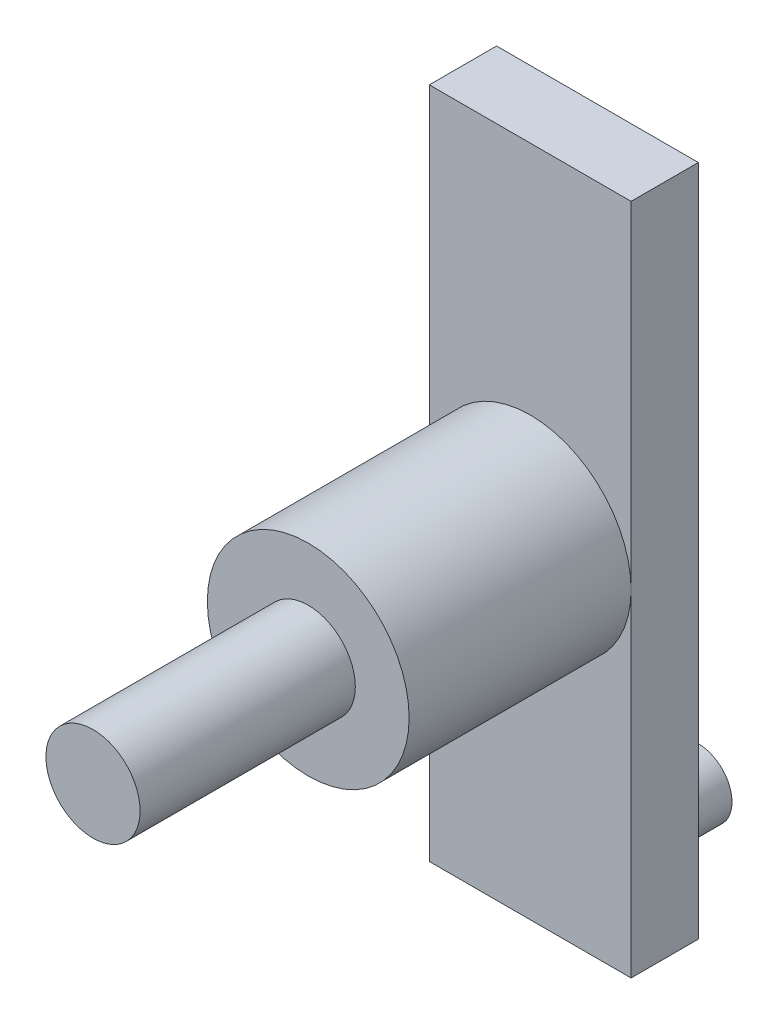
from build123d import *

# Parameters (mm, degrees)
SKETCH1_R           = 7
BOSS_EXTRUDE1_DEPTH = 65
SKETCH1_3_R         = 15
SKETCH1_3_R_2       = 7
BOSS_EXTRUDE2_DEPTH = 33
SKETCH3_W           = 30
SKETCH3_H           = 100
BOSS_EXTRUDE4_DEPTH = 10
SKETCH4_R           = 5
BOSS_EXTRUDE5_DEPTH = 15


with BuildPart() as part:
    # Sketch1 → Boss-Extrude1 (new body)
    with BuildSketch(Plane.XY):
        Circle(SKETCH1_R)
    extrude(amount=BOSS_EXTRUDE1_DEPTH)

    # Sketch1<3> → Boss-Extrude2 (add)
    with BuildSketch(Plane.XY):
        Circle(SKETCH1_3_R)
        Circle(SKETCH1_3_R_2, mode=Mode.SUBTRACT)
    extrude(amount=BOSS_EXTRUDE2_DEPTH)

    # Sketch3 → Boss-Extrude4 (add)
    with BuildSketch(Plane(origin=(0, 0, 0), x_dir=(-1, 0, 0), z_dir=(0, 0, -1))):
        Rectangle(SKETCH3_W, SKETCH3_H)
    extrude(amount=BOSS_EXTRUDE4_DEPTH)

    # Sketch4 → Boss-Extrude5 (add)
    with BuildSketch(Plane(origin=(0, 0, -10), x_dir=(-1, 0, 0), z_dir=(0, 0, -1))):
        with Locations((0, -44.833870937)):
            Circle(SKETCH4_R)
    extrude(amount=BOSS_EXTRUDE5_DEPTH)


solid = part.part
